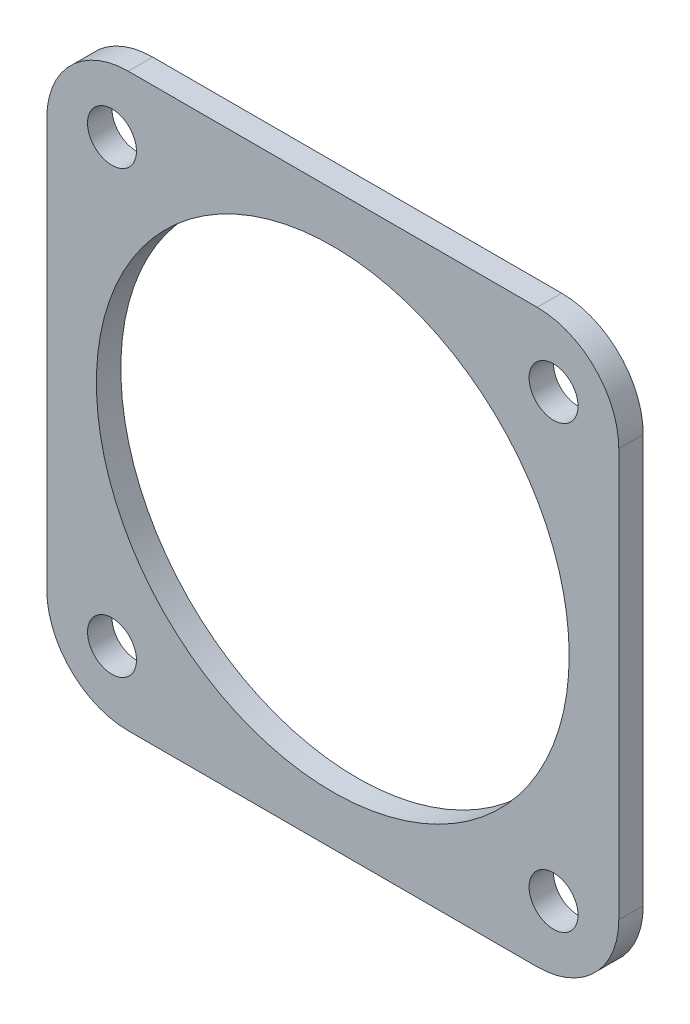
from build123d import *

# Parameters (mm, degrees)
CROQUIS1_W              = 70.164619522
CROQUIS1_H              = 70.068399122
CROQUIS1_R              = 35
CROQUIS1_R_2            = 29
SALIENTE_EXTRUIR1_DEPTH = 3
REDONDEO1_R             = 10
CROQUIS2_R              = 3
CORTAR_EXTRUIR1_DEPTH   = 10


with BuildPart() as part:
    # Croquis1 → Saliente-Extruir1 (new body)
    # profile 1 of 2: a face of its own
    with BuildSketch(Plane.XY):
        Rectangle(CROQUIS1_W, CROQUIS1_H)
        Circle(CROQUIS1_R, mode=Mode.SUBTRACT)
    # profile 2 of 2: a face of its own
    with BuildSketch(Plane.XY):
        Circle(CROQUIS1_R)
        Circle(CROQUIS1_R_2, mode=Mode.SUBTRACT)
    extrude(amount=SALIENTE_EXTRUIR1_DEPTH)

    # Redondeo1
    redondeo1_edges = [part.edges().sort_by_distance(p)[0] for p in [
        (35.082309761, -35.034199561, 1.5),
        (-35.082309761, -35.034199561, 1.5),
        (-35.082309761, 35.034199561, 1.5),
        (35.082309761, 35.034199561, 1.5),
    ]]
    fillet(redondeo1_edges, radius=REDONDEO1_R)

    # Croquis2 → Cortar-Extruir1 (cut)
    with BuildSketch(Plane(origin=(0, 0, 0), x_dir=(-1, 0, 0), z_dir=(0, 0, -1))):
        with Locations((-27.082309761, 27.034199561)):
            Circle(CROQUIS2_R)
        with Locations((27.082309761, 27.034199561)):
            Circle(CROQUIS2_R)
        with Locations((-27.082309761, -27.034199561)):
            Circle(CROQUIS2_R)
        with Locations((27.082309761, -27.034199561)):
            Circle(CROQUIS2_R)
    extrude(amount=-CORTAR_EXTRUIR1_DEPTH, mode=Mode.SUBTRACT)


solid = part.part
